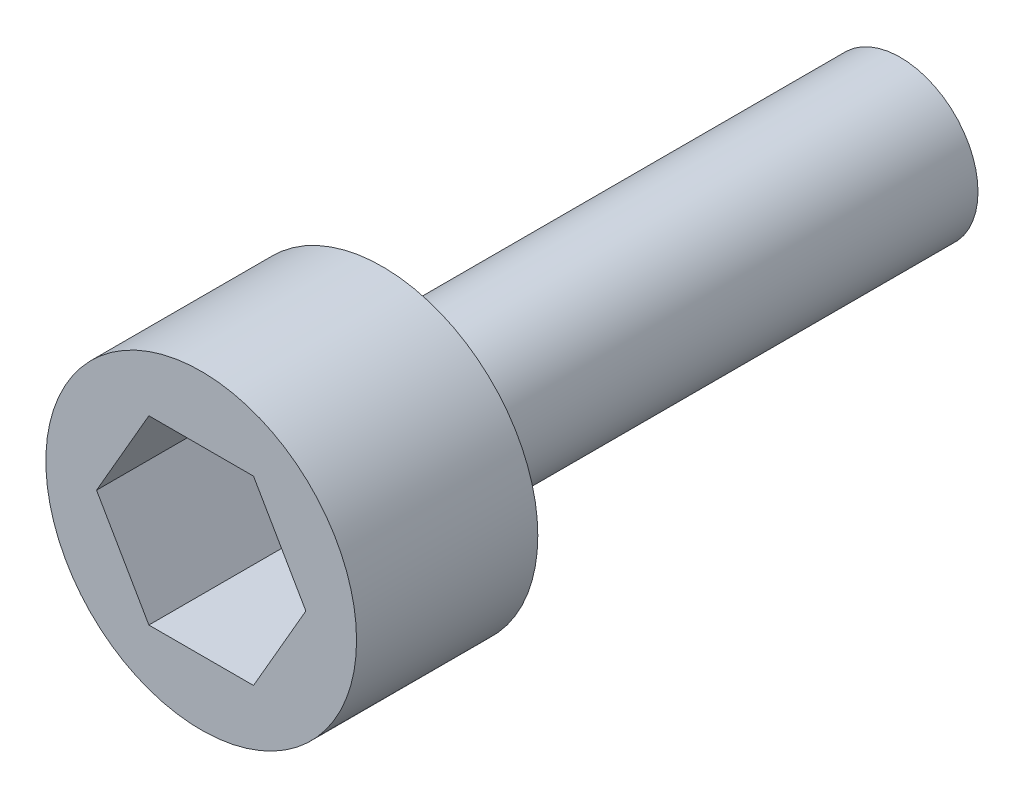
from build123d import *

# Parameters (mm, degrees)
SKETCH1_R                   = 3
HEAD_BOSS_EXTRUDE1_DEPTH    = 3.5
HEAD_HEX_CUT_EXTRUDE1_DEPTH = 2.8
SKETCH2_R                   = 1.5
SCREW_BOSS_EXTRUDE2_DEPTH   = 10


with BuildPart() as part:
    # Sketch1 → Head Boss-Extrude1 (new body)
    with BuildSketch(Plane.XY):
        Circle(SKETCH1_R)
    extrude(amount=HEAD_BOSS_EXTRUDE1_DEPTH)

    # Sketch3 → Head Hex Cut-Extrude1 (cut)
    with BuildSketch(Plane.XY.offset(3.5)):
        Polygon((-1.010362971, 1.75), (1.010362971, 1.75), (2.020725942, 0), (1.010362971, -1.75), (-1.010362971, -1.75), (-2.020725942, 0), align=None)
    extrude(amount=-HEAD_HEX_CUT_EXTRUDE1_DEPTH, mode=Mode.SUBTRACT)

    # Sketch2 → Screw Boss-Extrude2 (add)
    with BuildSketch(Plane.XY):
        Circle(SKETCH2_R)
    extrude(amount=-SCREW_BOSS_EXTRUDE2_DEPTH)


solid = part.part
